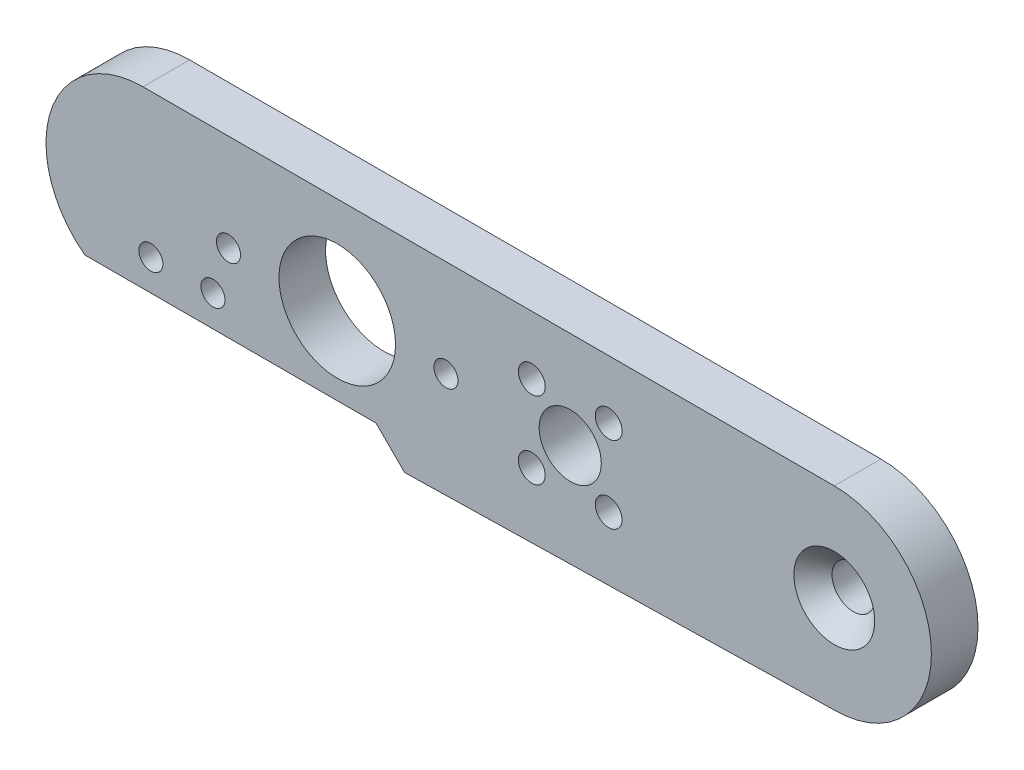
from build123d import *

# Parameters (mm, degrees)
SKETCH1_R           = 4
SKETCH1_R_2         = 1.726448843
SKETCH1_R_3         = 7.5
SKETCH1_R_4         = 1.55
BOSS_EXTRUDE1_DEPTH = 6
SKETCH4_R           = 1.55
CUT_EXTRUDE1_DEPTH  = 3
SKETCH5_R           = 3
CUT_EXTRUDE2_DEPTH  = 59.693125381


with BuildPart() as part:
    # Sketch1 → Boss-Extrude1 (new body)
    with BuildSketch(Plane.XY):
        with BuildLine():
            Line((-44.5, 12.5), (44.5, 12.5))
            ThreePointArc((44.5, 12.5), (57, 0), (44.5, -12.5))
            Line((44.5, -12.5), (-10.829485489, -13.670514511))
            Line((-10.829485489, -13.670514511), (-14.5, -10))
            Line((-14.5, -10), (-52, -10))
            ThreePointArc((-52, -10), (-56.358541226, 3.952847075), (-44.5, 12.5))
        make_face()
        with Locations((10.5, 0)):
            Circle(SKETCH1_R, mode=Mode.SUBTRACT)
        with Locations((15.449747468, 4.949747468)):
            Circle(SKETCH1_R_2, mode=Mode.SUBTRACT)
        with Locations(Location((5.550252532, 4.949747468, 0), (0, 0, 180))):
            Circle(SKETCH1_R_2, mode=Mode.SUBTRACT)
        with Locations((5.550252532, -4.949747468)):
            Circle(SKETCH1_R_2, mode=Mode.SUBTRACT)
        with Locations(Location((15.449747468, -4.949747468, 0), (0, 0, 180))):
            Circle(SKETCH1_R_2, mode=Mode.SUBTRACT)
        with Locations((-19.5, 0)):
            Circle(SKETCH1_R_3, mode=Mode.SUBTRACT)
        with Locations((-5.5, 0)):
            Circle(SKETCH1_R_4, mode=Mode.SUBTRACT)
        with Locations((-33.5, 0)):
            Circle(SKETCH1_R_4, mode=Mode.SUBTRACT)
    extrude(amount=BOSS_EXTRUDE1_DEPTH)

    # Sketch3 → CSK for M5 Flat Head Machine Screw1 (revolve, cut)
    with BuildSketch(Plane(origin=(44.5, 0, 6), x_dir=(0, -1, 0), z_dir=(1, 0, 0))):
        Polygon((0, 0), (0, 6), (2.925, 6), (2.75, 5.825), (2.75, 2.45), (5.2, 0), align=None)
    revolve(axis=Axis((44.5, 0, 12.35), (0, 0, -1)), mode=Mode.SUBTRACT)

    # Sketch4 → Cut-Extrude1 (cut)
    with BuildSketch(Plane.XY.offset(6)):
        with Locations((-43.5, -6)):
            Circle(SKETCH4_R)
        with Locations((-35.5, -6)):
            Circle(SKETCH4_R)
    extrude(amount=-CUT_EXTRUDE1_DEPTH, mode=Mode.SUBTRACT)

    # Sketch5 → Cut-Extrude2 (cut, through all)
    with BuildSketch(Plane.XY.offset(3)):
        with Locations((-35.5, -6)):
            Circle(SKETCH5_R)
        with Locations((-43.5, -6)):
            Circle(SKETCH5_R)
    extrude(amount=-CUT_EXTRUDE2_DEPTH, mode=Mode.SUBTRACT)


solid = part.part
